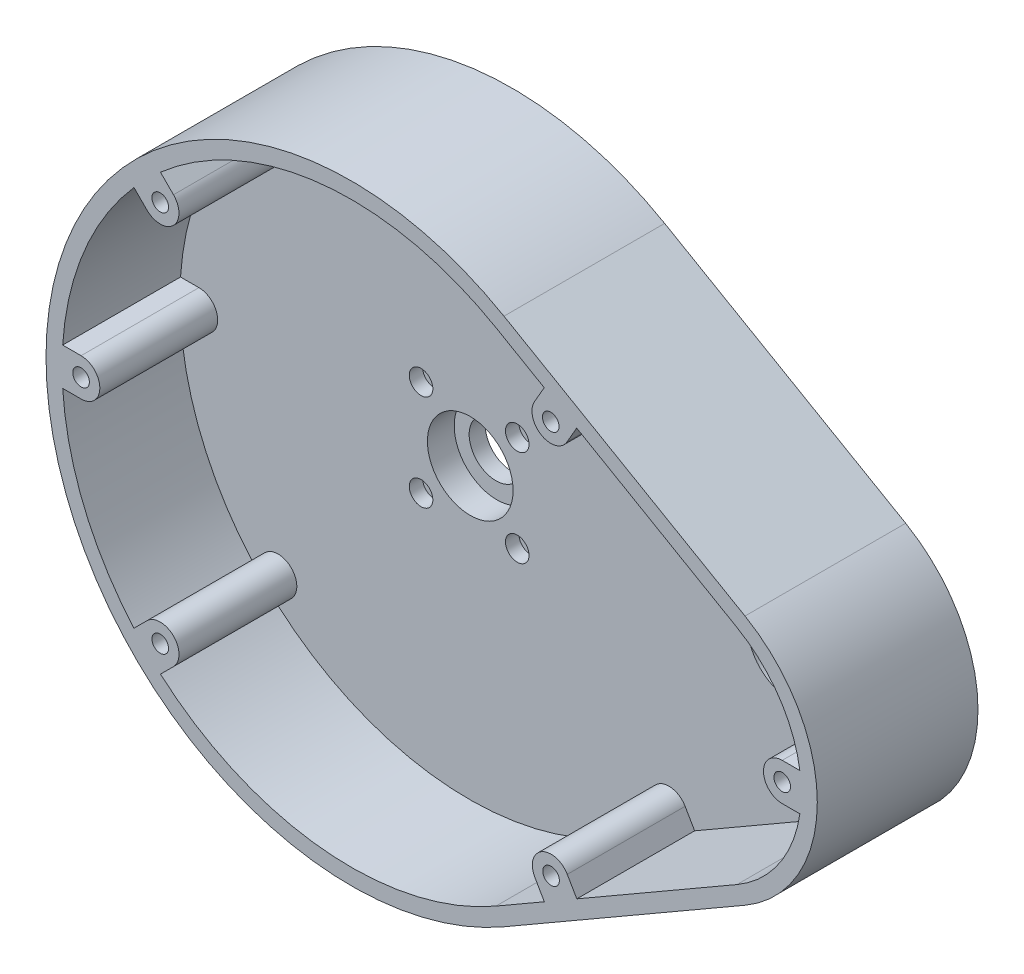
from build123d import *

# Parameters (mm, degrees)
BOSS_EXTRUDE1_DEPTH = 30
SKETCH3_R           = 1.55
CUT_EXTRUDE1_DEPTH  = 22
CUT_EXTRUDE2_START  = -30
SKETCH5_R           = 1.55
CUT_EXTRUDE2_DEPTH  = 30
SKETCH6_R           = 3
CUT_EXTRUDE3_DEPTH  = 5
SKETCH7_R           = 8
CUT_EXTRUDE10_DEPTH = 5
SKETCH8_R           = 5
SKETCH8_R_2         = 1.05
CUT_EXTRUDE7_DEPTH  = 8
SKETCH9_R           = 2.2
CUT_EXTRUDE8_DEPTH  = 2.5


with BuildPart() as part:
    # Sketch1 → Boss-Extrude1 (new body)
    with BuildSketch(Plane.XY):
        with BuildLine():
            Line((-1.5, 49.363448016), (43.5, 23.382685902))
            ThreePointArc((43.5, 23.382685902), (57, 0), (43.5, -23.382685902))
            Line((43.5, -23.382685902), (-1.5, -49.363448016))
            ThreePointArc((-1.5, -49.363448016), (-87, 0), (-1.5, 49.363448016))
        make_face()
    extrude(amount=BOSS_EXTRUDE1_DEPTH)

    # Sketch3 → Cut-Extrude1 (cut)
    with BuildSketch(Plane.XY.offset(30)):
        with Locations((50.449984706, 0.025940866)):
            Circle(SKETCH3_R)
        with Locations((-80.45, 0)):
            Circle(SKETCH3_R)
        with Locations((-65.673537111, 35.673537111)):
            Circle(SKETCH3_R)
        with Locations((-65.673537111, -35.673537111)):
            Circle(SKETCH3_R)
        with Locations((7.233447448, 36.661458689)):
            Circle(SKETCH3_R)
        with Locations((7.291641994, -36.724302618)):
            Circle(SKETCH3_R)
        with BuildLine():
            Line((50.449984706, 3.525940866), (53.739581736, 3.525940866))
            ThreePointArc((53.739581736, 3.525940866), (49.844264614, 13.498339229), (42, 20.784609691))
            Line((42, 20.784609691), (12.081289905, 38.058185018))
            Line((12.081289905, 38.058185018), (10.268372938, 34.918120721))
            ThreePointArc((10.268372938, 34.918120721), (5.49010948, 33.626533199), (4.198521958, 38.404796657))
            Line((4.198521958, 38.404796657), (6.019126703, 41.558176575))
            Line((6.019126703, 41.558176575), (-3, 46.765371804))
            ThreePointArc((-3, 46.765371804), (-35.308766962, 53.738412643), (-65.628603797, 40.578351266))
            Line((-65.628603797, 40.578351266), (-63.198663377, 38.148410845))
            ThreePointArc((-63.198663377, 38.148410845), (-63.198663377, 33.198663377), (-68.148410845, 33.198663377))
            Line((-68.148410845, 33.198663377), (-70.578351266, 35.628603797))
            ThreePointArc((-70.578351266, 35.628603797), (-79.889494756, 20.664905348), (-83.886454699, 3.5))
            Line((-83.886454699, 3.5), (-80.45, 3.5))
            ThreePointArc((-80.45, 3.5), (-76.95, 0), (-80.45, -3.5))
            Line((-80.45, -3.5), (-83.886454699, -3.5))
            ThreePointArc((-83.886454699, -3.5), (-79.889494756, -20.664905348), (-70.578351266, -35.628603797))
            Line((-70.578351266, -35.628603797), (-68.148410845, -33.198663377))
            ThreePointArc((-68.148410845, -33.198663377), (-63.198663377, -33.198663377), (-63.198663377, -38.148410845))
            Line((-63.198663377, -38.148410845), (-65.628603797, -40.578351266))
            ThreePointArc((-65.628603797, -40.578351266), (-35.308766962, -53.738412643), (-3, -46.765371804))
            Line((-3, -46.765371804), (6.035553081, -41.548692801))
            Line((6.035553081, -41.548692801), (4.260553081, -38.474302618))
            ThreePointArc((4.260553081, -38.474302618), (5.541641994, -33.693213705), (10.322730907, -34.974302618))
            Line((10.322730907, -34.974302618), (12.097730907, -38.048692801))
            Line((12.097730907, -38.048692801), (42, -20.784609691))
            ThreePointArc((42, -20.784609691), (49.859000377, -13.476650327), (53.747229589, -3.474059134))
            Line((53.747229589, -3.474059134), (50.449984706, -3.474059134))
            ThreePointArc((50.449984706, -3.474059134), (46.949984706, 0.025940866), (50.449984706, 3.525940866))
        make_face()
    extrude(amount=-CUT_EXTRUDE1_DEPTH, mode=Mode.SUBTRACT)

    # Sketch5 → Cut-Extrude2 (cut)
    with BuildSketch(Plane(origin=(0, 0, 0), x_dir=(-1, 0, 0), z_dir=(0, 0, -1)).offset(CUT_EXTRUDE2_START)):
        with Locations(Location((65.673537111, 35.673537111, 0), (0, 0, 180))):
            Circle(SKETCH5_R)
        with Locations(Location((80.45, 0, 0), (0, 0, 180))):
            Circle(SKETCH5_R)
        with Locations(Location((-7.233447448, 36.661458689, 0), (0, 0, 180))):
            Circle(SKETCH5_R)
        with Locations(Location((-50.449984706, 0.025940866, 0), (0, 0, 180))):
            Circle(SKETCH5_R)
        with Locations(Location((-7.291641994, -36.724302618, 0), (0, 0, 180))):
            Circle(SKETCH5_R)
        with Locations(Location((65.673537111, -35.673537111, 0), (0, 0, 180))):
            Circle(SKETCH5_R)
    extrude(amount=CUT_EXTRUDE2_DEPTH, mode=Mode.SUBTRACT)

    # Sketch6 → Cut-Extrude3 (cut)
    with BuildSketch(Plane(origin=(0, 0, 0), x_dir=(-1, 0, 0), z_dir=(0, 0, -1))):
        with Locations((-50.449984706, 0.025940866)):
            Circle(SKETCH6_R)
        with Locations((-7.291641994, -36.724302618)):
            Circle(SKETCH6_R)
        with Locations((65.673537111, -35.673537111)):
            Circle(SKETCH6_R)
        with Locations((80.45, 0)):
            Circle(SKETCH6_R)
        with Locations((65.673537111, 35.673537111)):
            Circle(SKETCH6_R)
        with Locations((-7.233447448, 36.661458689)):
            Circle(SKETCH6_R)
    extrude(amount=-CUT_EXTRUDE3_DEPTH, mode=Mode.SUBTRACT)

    # Sketch7 → Cut-Extrude10 (cut)
    with BuildSketch(Plane.XY.offset(8)):
        with Locations((-29.795862437, 0)):
            Circle(SKETCH7_R)
        with Locations((30, 0)):
            Circle(SKETCH7_R)
    extrude(amount=-CUT_EXTRUDE10_DEPTH, mode=Mode.SUBTRACT)

    # Sketch8 → Cut-Extrude7 (cut)
    with BuildSketch(Plane.XY.offset(8)):
        with Locations((-30, 0)):
            Circle(SKETCH8_R)
        with Locations((-38.980256121, 8.980256121)):
            Circle(SKETCH8_R_2)
        with Locations((-21.019743879, 8.980256121)):
            Circle(SKETCH8_R_2)
        with Locations((-21.019743879, -8.980256121)):
            Circle(SKETCH8_R_2)
        with Locations((-38.980256121, -8.980256121)):
            Circle(SKETCH8_R_2)
    extrude(amount=-CUT_EXTRUDE7_DEPTH, mode=Mode.SUBTRACT)

    # Sketch9 → Cut-Extrude8 (cut)
    with BuildSketch(Plane.XY.offset(8)):
        with Locations((-38.980256121, 8.980256121)):
            Circle(SKETCH9_R)
        with Locations((-21.019743879, 8.980256121)):
            Circle(SKETCH9_R)
        with Locations((-21.019743879, -8.980256121)):
            Circle(SKETCH9_R)
        with Locations((-38.980256121, -8.980256121)):
            Circle(SKETCH9_R)
    extrude(amount=-CUT_EXTRUDE8_DEPTH, mode=Mode.SUBTRACT)


solid = part.part
